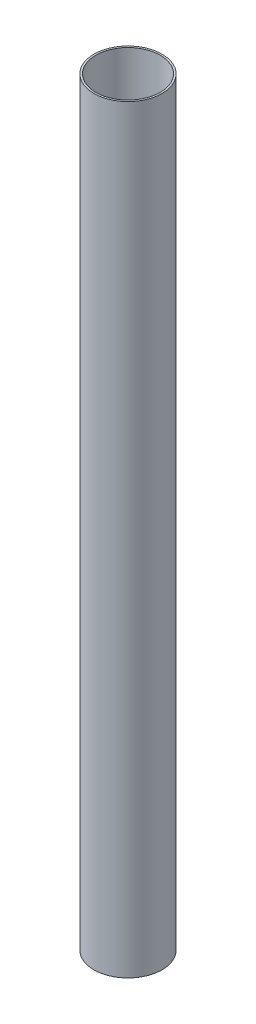
from build123d import *

# Parameters (mm, degrees)
SKETCH1_R           = 25.1714
SKETCH1_R_2         = 23.8125
BOSS_EXTRUDE1_DEPTH = 560.9336


with BuildPart() as part:
    # Sketch1 → Boss-Extrude1 (new body)
    with BuildSketch(Plane(origin=(0, 0, 0), x_dir=(1, 0, 0), z_dir=(0, 1, 0))):
        with Locations(Location((0, 0, 0), (0, 0, 270))):
            Circle(SKETCH1_R)
        with Locations(Location((0, 0, 0), (0, 0, 270))):
            Circle(SKETCH1_R_2, mode=Mode.SUBTRACT)
    extrude(amount=BOSS_EXTRUDE1_DEPTH)


solid = part.part
